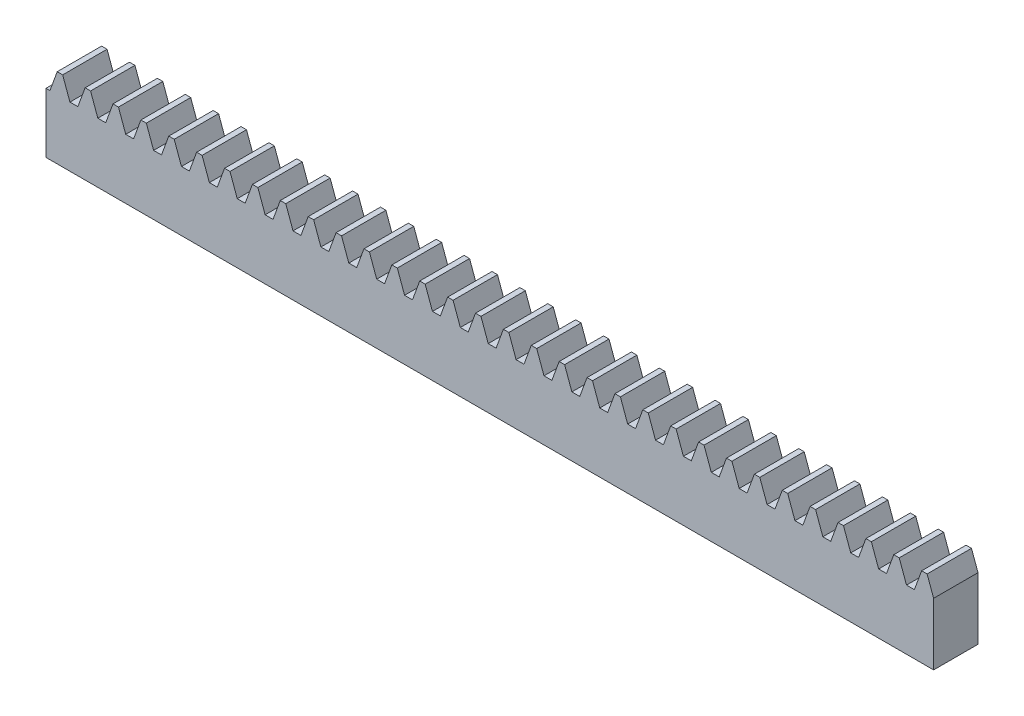
from build123d import *

# Parameters (mm, degrees)
BLANKSKE_W        = 100
BLANKSKE_H        = 9
BLANK_DEPTH       = 5
TOOTHCUTSIM_DEPTH = 101.528602895
TEETHCUTS_COUNT   = 33
TEETHCUTS_PITCH   = 3.14159265


with BuildPart() as part:
    # BlankSke → Blank (new body)
    with BuildSketch(Plane.XY):
        with Locations((50, 4.5)):
            Rectangle(BLANKSKE_W, BLANKSKE_H)
    extrude(amount=-BLANK_DEPTH)

    # TooCutSkeSim → ToothCutSim (cut, through all)
    with BuildSketch(Plane.XY):
        Polygon((0.44443537, 6.75), (-0.44443537, 6.75), (-1.272613241, 9.0254), (1.272613241, 9.0254), align=None)
    toothcutsim = extrude(amount=-TOOTHCUTSIM_DEPTH, mode=Mode.SUBTRACT)

    # TeethCuts: ToothCutSim ×33
    with Locations(*[(i * TEETHCUTS_PITCH, 0, 0) for i in range(1, TEETHCUTS_COUNT)]):
        add(toothcutsim, mode=Mode.SUBTRACT)


solid = part.part
